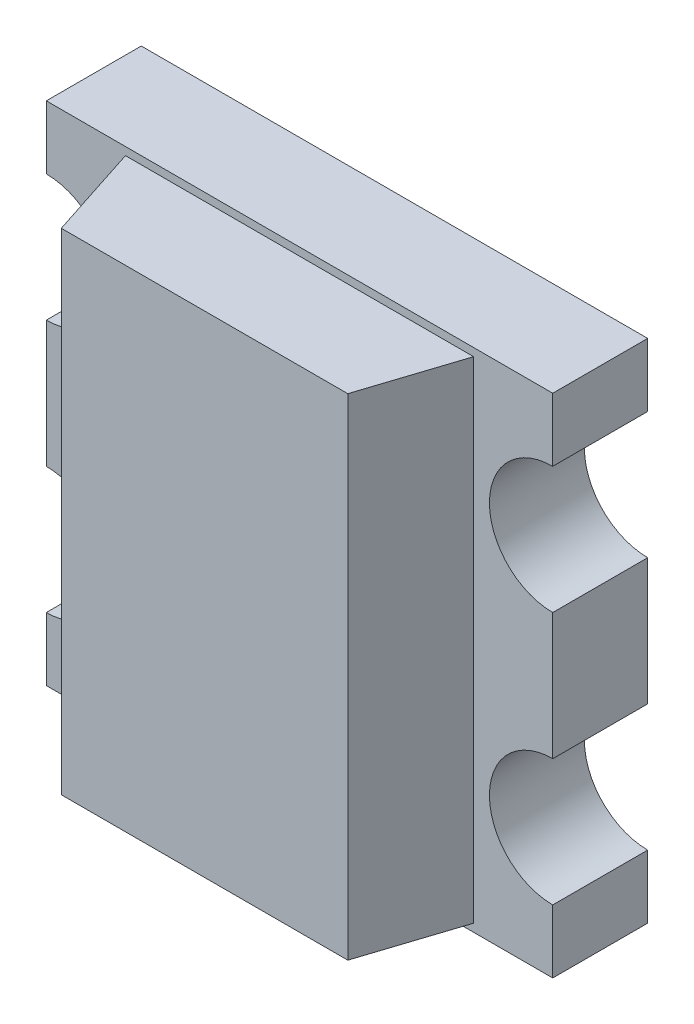
from build123d import *

# Parameters (mm, degrees)
BOSS_EXTRUDE1_DEPTH = 0.3
BOSS_EXTRUDE2_DEPTH = 0.775


with BuildPart() as part:
    # Sketch2 → Boss-Extrude1 (new body)
    with BuildSketch(Plane.XY):
        with BuildLine():
            Line((-0.8, 0.8), (0.8, 0.8))
            Line((0.8, 0.8), (0.8, 0.6))
            ThreePointArc((0.8, 0.6), (0.6, 0.4), (0.8, 0.2))
            Line((0.8, 0.2), (0.8, -0.2))
            ThreePointArc((0.8, -0.2), (0.6, -0.4), (0.8, -0.6))
            Line((0.8, -0.6), (0.8, -0.8))
            Line((0.8, -0.8), (-0.8, -0.8))
            Line((-0.8, -0.8), (-0.8, -0.6))
            ThreePointArc((-0.8, -0.6), (-0.6, -0.4), (-0.8, -0.2))
            Line((-0.8, -0.2), (-0.8, 0.2))
            ThreePointArc((-0.8, 0.2), (-0.6, 0.4), (-0.8, 0.6))
            Line((-0.8, 0.6), (-0.8, 0.8))
        make_face()
    extrude(amount=BOSS_EXTRUDE1_DEPTH)

    # Sketch3 → Boss-Extrude2 (add, symmetric)
    with BuildSketch(Plane(origin=(0, 0, 0), x_dir=(1, 0, 0), z_dir=(0, 1, 0))):
        Polygon((0.55, -0.3), (0.452524091, -0.6), (-0.452524091, -0.6), (-0.55, -0.3), align=None)
    extrude(amount=BOSS_EXTRUDE2_DEPTH, both=True)


solid = part.part
